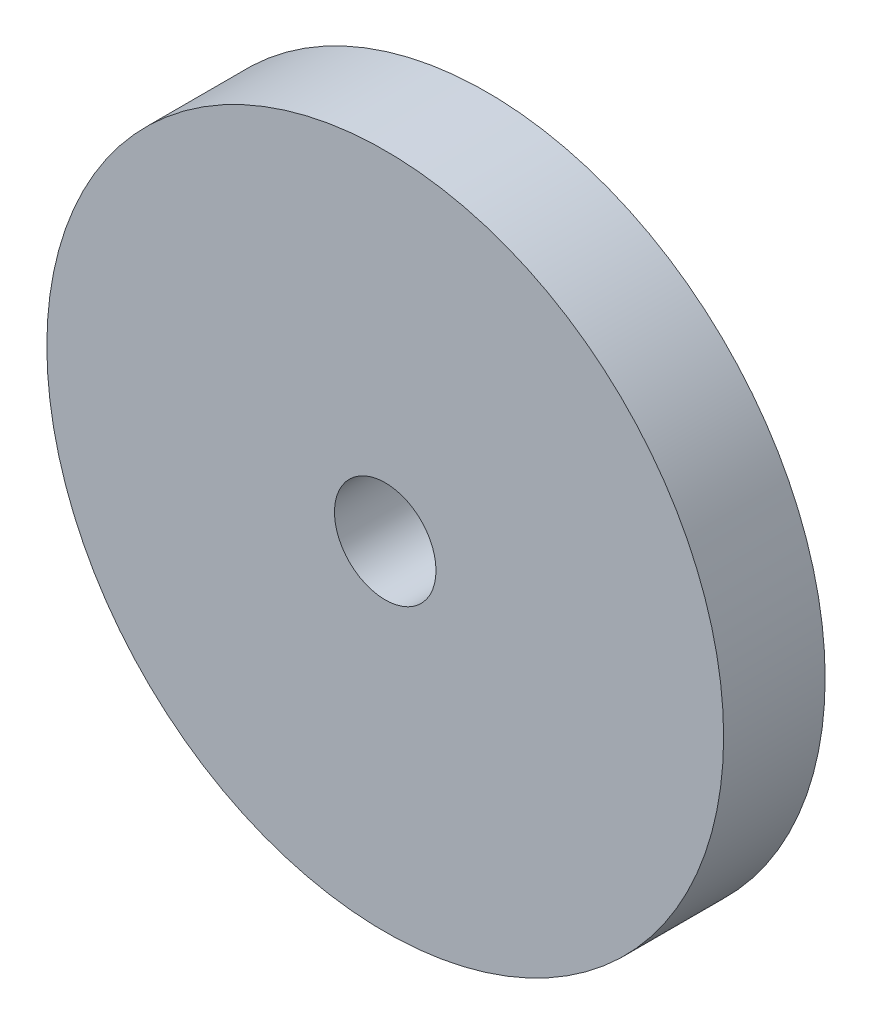
from build123d import *

# Parameters (mm, degrees)
SKETCH1_R           = 50
SKETCH1_R_2         = 7.5
BOSS_EXTRUDE1_DEPTH = 15


with BuildPart() as part:
    # Sketch1 → Boss-Extrude1 (new body)
    with BuildSketch(Plane.XY):
        with Locations((-25, -10)):
            Circle(SKETCH1_R)
        with Locations((-25, -10)):
            Circle(SKETCH1_R_2, mode=Mode.SUBTRACT)
    extrude(amount=-BOSS_EXTRUDE1_DEPTH)


solid = part.part
